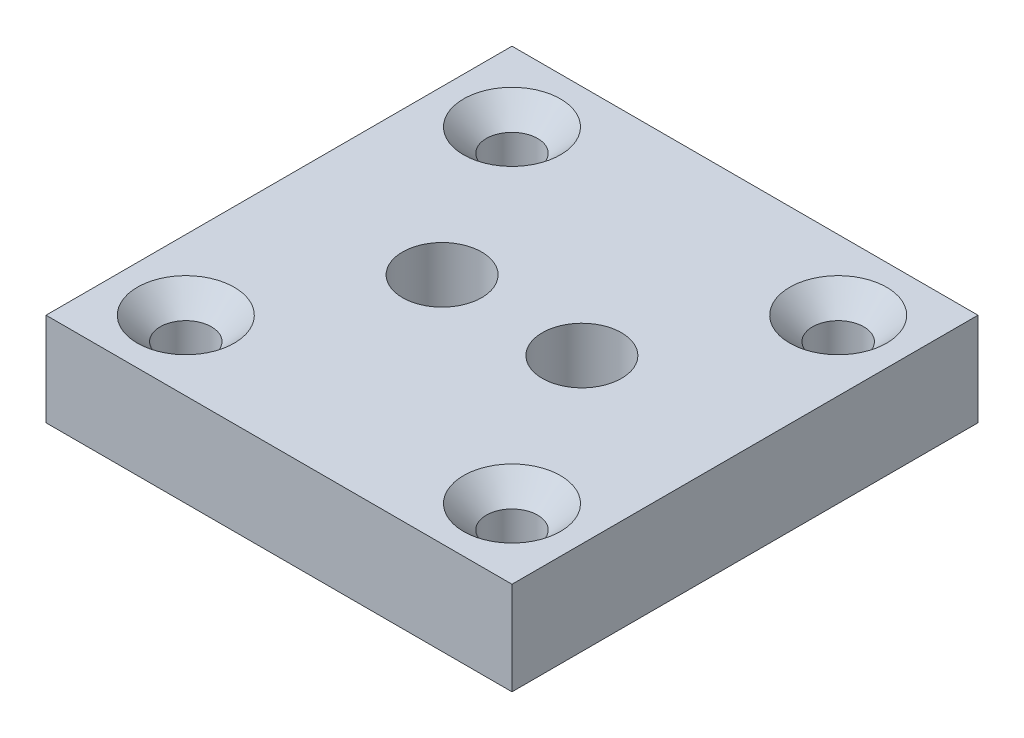
from build123d import *

# Parameters (mm, degrees)
SKETCH2_W                                       = 50
SKETCH2_H                                       = 10
BOSS_EXTRUDE1_DEPTH                             = 50
TAP_DRILL_FOR_M10_TAP1_D                        = 8.5
CSK_FOR_M5_FLAT_HEAD_MACHINE_SCREW2_D           = 5.5
CSK_FOR_M5_FLAT_HEAD_MACHINE_SCREW2_CSINK_D     = 10.4
CSK_FOR_M5_FLAT_HEAD_MACHINE_SCREW2_CSINK_ANGLE = 90


with BuildPart() as part:
    # Sketch2 → Boss-Extrude1 (new body)
    with BuildSketch(Plane.XY):
        with Locations((25, 5)):
            Rectangle(SKETCH2_W, SKETCH2_H)
    extrude(amount=BOSS_EXTRUDE1_DEPTH)

    # Tap Drill for M10 Tap1 (through all)
    with Locations(Plane(origin=(0, 10, 0), x_dir=(1, 0, 0), z_dir=(0, 1, 0))):
        with Locations((17.5, -25), (32.5, -25)):
            Hole(TAP_DRILL_FOR_M10_TAP1_D / 2)

    # CSK for M5 Flat Head Machine Screw2 (through all)
    with Locations(Plane(origin=(0, 10, 0), x_dir=(1, 0, 0), z_dir=(0, 1, 0))):
        with Locations((7.5, -7.5), (42.5, -7.5), (42.5, -42.5), (7.5, -42.5)):
            CounterSinkHole(CSK_FOR_M5_FLAT_HEAD_MACHINE_SCREW2_D / 2, CSK_FOR_M5_FLAT_HEAD_MACHINE_SCREW2_CSINK_D / 2, counter_sink_angle=CSK_FOR_M5_FLAT_HEAD_MACHINE_SCREW2_CSINK_ANGLE)


solid = part.part
